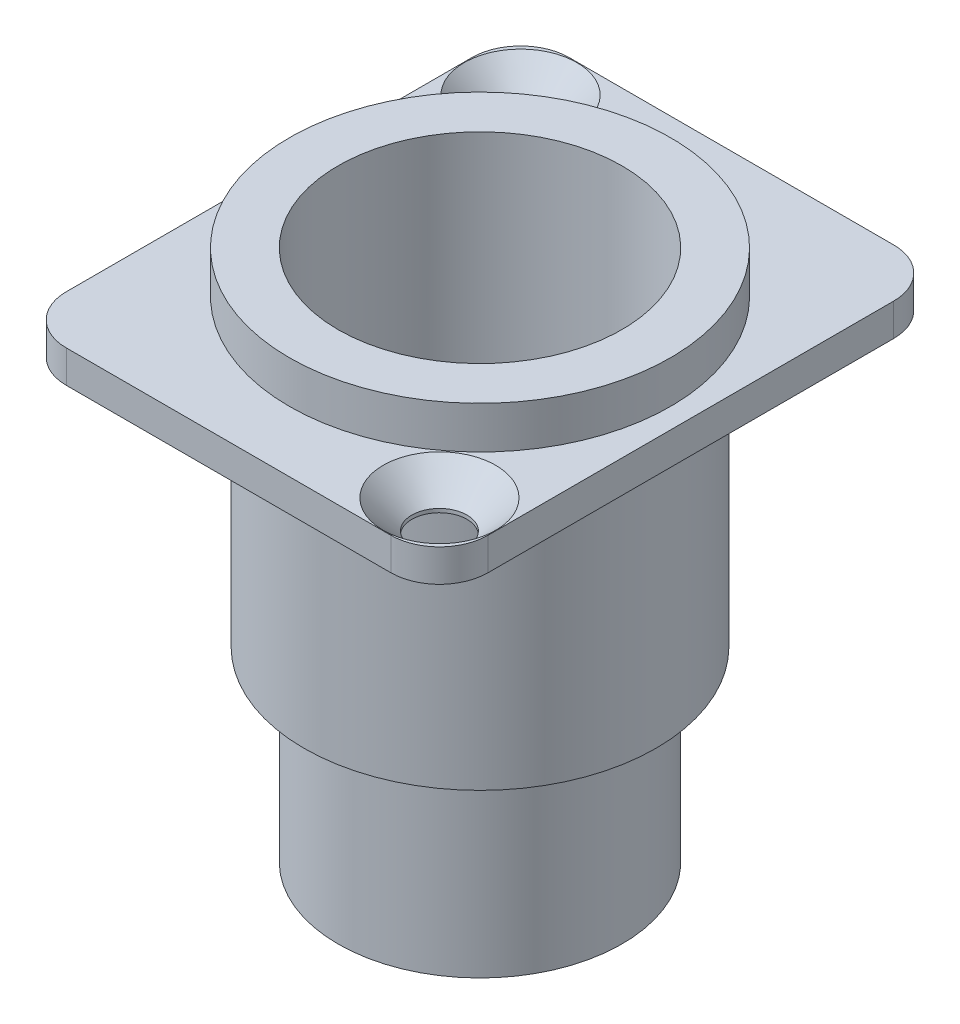
from build123d import *

# Parameters (mm, degrees)
CROQUIS1_W                                           = 26
CROQUIS1_H                                           = 31
CROQUIS1_R                                           = 8.75
CROQUIS1_R_2                                         = 1.7
SALIENTE_EXTRUIR1_DEPTH                              = 2
REDONDEO1_R                                          = 3
CROQUIS2_R                                           = 11.75
CROQUIS2_R_2                                         = 8.75
SALIENTE_EXTRUIR2_DEPTH                              = 2.6
SALIENTE_EXTRUIR3_START                              = 16.7
CROQUIS3_R                                           = 10.85
CROQUIS3_R_2                                         = 8.75
SALIENTE_EXTRUIR3_DEPTH                              = 16.7
AVELLANADO_PARA_TORNILLOS_CON_CABEZA_AVE_D           = 3.4
AVELLANADO_PARA_TORNILLOS_CON_CABEZA_AVE_DEPTH       = 15
AVELLANADO_PARA_TORNILLOS_CON_CABEZA_AVE_CSINK_D     = 6.94
AVELLANADO_PARA_TORNILLOS_CON_CABEZA_AVE_CSINK_ANGLE = 90
AVELLANADO_PARA_TORNILLOS_CON_CABEZA_AVE_TIP         = 1.021463052
CROQUIS6_R                                           = 8.75
SALIENTE_EXTRUIR4_DEPTH                              = 32.8
CROQUIS7_W                                           = 12.7
CROQUIS7_H                                           = 5.4
CORTAR_EXTRUIR1_DEPTH                                = 10
CROQUIS8_W                                           = 12.7
CROQUIS8_H                                           = 5.4
CORTAR_EXTRUIR2_DEPTH                                = 10
CROQUIS9_W                                           = 12.7
CROQUIS9_H                                           = 5.4
CROQUIS9_W_2                                         = 12.3
CROQUIS9_H_2                                         = 5
SALIENTE_EXTRUIR5_DEPTH                              = 10
CROQUIS10_W                                          = 12.7
CROQUIS10_H                                          = 5.4
CROQUIS10_W_2                                        = 12.3
CROQUIS10_H_2                                        = 5
SALIENTE_EXTRUIR6_DEPTH                              = 10
CROQUIS11_W                                          = 12.3
CROQUIS11_H                                          = 5
SALIENTE_EXTRUIR7_DEPTH                              = 0.7
CROQUIS12_W                                          = 12.3
CROQUIS12_H                                          = 5
SALIENTE_EXTRUIR8_DEPTH                              = 0.7
CROQUIS13_W                                          = 11
CROQUIS13_H                                          = 2
SALIENTE_EXTRUIR9_DEPTH                              = 9
CROQUIS14_W                                          = 11
CROQUIS14_H                                          = 2
SALIENTE_EXTRUIR10_DEPTH                             = 9
CHAFL_N1_SIZE                                        = 0.5
CHAFL_N2_SIZE                                        = 0.5
CUT_EXTRUDE1_START                                   = -20
SKETCH1_R                                            = 8.75
CUT_EXTRUDE1_DEPTH                                   = 20


with BuildPart() as part:
    # Croquis1 → Saliente-Extruir1 (new body)
    with BuildSketch(Plane(origin=(0, 0, 0), x_dir=(1, 0, 0), z_dir=(0, 1, 0))):
        Rectangle(CROQUIS1_W, CROQUIS1_H)
        with Locations(Location((0, 0, 0), (0, 0, 270))):
            Circle(CROQUIS1_R, mode=Mode.SUBTRACT)
        with Locations(Location((-9.5, 12, 0), (0, 0, 270))):
            Circle(CROQUIS1_R_2, mode=Mode.SUBTRACT)
        with Locations(Location((9.5, -12, 0), (0, 0, 270))):
            Circle(CROQUIS1_R_2, mode=Mode.SUBTRACT)
    extrude(amount=SALIENTE_EXTRUIR1_DEPTH)

    # Redondeo1
    redondeo1_edges = [part.edges().sort_by_distance(p)[0] for p in [
        (13, 1, 15.5),
        (-13, 1, 15.5),
        (-13, 1, -15.5),
        (13, 1, -15.5),
    ]]
    fillet(redondeo1_edges, radius=REDONDEO1_R)

    # Croquis2 → Saliente-Extruir2 (add)
    with BuildSketch(Plane(origin=(0, 2, 0), x_dir=(1, 0, 0), z_dir=(0, 1, 0))):
        with Locations(Location((0, 0, 0), (0, 0, 270))):
            Circle(CROQUIS2_R)
        with Locations(Location((0, 0, 0), (0, 0, 270))):
            Circle(CROQUIS2_R_2, mode=Mode.SUBTRACT)
    extrude(amount=SALIENTE_EXTRUIR2_DEPTH)

    # Croquis3 → Saliente-Extruir3 (add)
    with BuildSketch(Plane.XZ.offset(SALIENTE_EXTRUIR3_START)):
        with Locations(Location((0, 0, 0), (0, 0, 270))):
            Circle(CROQUIS3_R)
        with Locations(Location((0, 0, 0), (0, 0, 270))):
            Circle(CROQUIS3_R_2, mode=Mode.SUBTRACT)
    extrude(amount=-SALIENTE_EXTRUIR3_DEPTH)

    # Avellanado para tornillos con cabeza avellanada de clavija de M31
    with Locations(Plane(origin=(0, 2, 0), x_dir=(1, 0, 0), z_dir=(0, 1, 0))):
        with Locations((9.5, -12), (-9.5, 12)):
            CounterSinkHole(AVELLANADO_PARA_TORNILLOS_CON_CABEZA_AVE_D / 2, AVELLANADO_PARA_TORNILLOS_CON_CABEZA_AVE_CSINK_D / 2, depth=AVELLANADO_PARA_TORNILLOS_CON_CABEZA_AVE_DEPTH, counter_sink_angle=AVELLANADO_PARA_TORNILLOS_CON_CABEZA_AVE_CSINK_ANGLE)
            with Locations((0, 0, -(AVELLANADO_PARA_TORNILLOS_CON_CABEZA_AVE_DEPTH + AVELLANADO_PARA_TORNILLOS_CON_CABEZA_AVE_TIP / 2))):  # 118° drill point
                Cone(0, AVELLANADO_PARA_TORNILLOS_CON_CABEZA_AVE_D / 2, AVELLANADO_PARA_TORNILLOS_CON_CABEZA_AVE_TIP, mode=Mode.SUBTRACT)


with BuildPart() as body_2:
    # Croquis6 → Saliente-Extruir4 (new body)
    with BuildSketch(Plane(origin=(0, 4.6, 0), x_dir=(1, 0, 0), z_dir=(0, 1, 0))):
        with Locations(Location((0, 0, 0), (0, 0, 270))):
            Circle(CROQUIS6_R)
    extrude(amount=-SALIENTE_EXTRUIR4_DEPTH)

    # Croquis7 → Cortar-Extruir1 (cut)
    with BuildSketch(Plane(origin=(0, 4.6, 0), x_dir=(1, 0, 0), z_dir=(0, 1, 0))):
        Rectangle(CROQUIS7_W, CROQUIS7_H)
    extrude(amount=-CORTAR_EXTRUIR1_DEPTH, mode=Mode.SUBTRACT)

    # Croquis8 → Cortar-Extruir2 (cut)
    with BuildSketch(Plane.XZ.offset(28.2)):
        Rectangle(CROQUIS8_W, CROQUIS8_H)
    extrude(amount=-CORTAR_EXTRUIR2_DEPTH, mode=Mode.SUBTRACT)


with BuildPart() as body_3:
    # Croquis9 → Saliente-Extruir5 (new body)
    with BuildSketch(Plane.XZ.offset(28.2)):
        Rectangle(CROQUIS9_W, CROQUIS9_H)
        Rectangle(CROQUIS9_W_2, CROQUIS9_H_2, mode=Mode.SUBTRACT)
    extrude(amount=-SALIENTE_EXTRUIR5_DEPTH)


with BuildPart() as body_4:
    # Croquis10 → Saliente-Extruir6 (new body)
    with BuildSketch(Plane(origin=(0, 4.6, 0), x_dir=(1, 0, 0), z_dir=(0, 1, 0))):
        Rectangle(CROQUIS10_W, CROQUIS10_H)
        Rectangle(CROQUIS10_W_2, CROQUIS10_H_2, mode=Mode.SUBTRACT)
    extrude(amount=-SALIENTE_EXTRUIR6_DEPTH)


with BuildPart() as body_5:
    # Croquis11 → Saliente-Extruir7 (new body)
    with BuildSketch(Plane(origin=(0, -5.4, 0), x_dir=(1, 0, 0), z_dir=(0, 1, 0))):
        Rectangle(CROQUIS11_W, CROQUIS11_H)
    extrude(amount=SALIENTE_EXTRUIR7_DEPTH)


with BuildPart() as body_6:
    # Croquis12 → Saliente-Extruir8 (new body)
    with BuildSketch(Plane.XZ.offset(18.2)):
        Rectangle(CROQUIS12_W, CROQUIS12_H)
    extrude(amount=SALIENTE_EXTRUIR8_DEPTH)


with BuildPart() as body_7:
    # Croquis13 → Saliente-Extruir9 (new body)
    with BuildSketch(Plane(origin=(0, -4.7, 0), x_dir=(1, 0, 0), z_dir=(0, 1, 0))):
        with Locations((0, -0.7)):
            Rectangle(CROQUIS13_W, CROQUIS13_H)
    extrude(amount=SALIENTE_EXTRUIR9_DEPTH)

    # Chaflán1
    chafl_n1_edges = [body_7.edges().sort_by_distance(p)[0] for p in [
        (-5.5, 4.3, 0.7),
        (0, 4.3, 1.7),
        (5.5, 4.3, 0.7),
        (0, 4.3, -0.3),
    ]]
    chamfer(chafl_n1_edges, length=CHAFL_N1_SIZE)


with BuildPart() as body_8:
    # Croquis14 → Saliente-Extruir10 (new body)
    with BuildSketch(Plane.XZ.offset(18.9)):
        with Locations((0, 0.7)):
            Rectangle(CROQUIS14_W, CROQUIS14_H)
    extrude(amount=SALIENTE_EXTRUIR10_DEPTH)

    # Chaflán2
    chafl_n2_edges = [body_8.edges().sort_by_distance(p)[0] for p in [
        (0, -27.9, -0.3),
        (5.5, -27.9, 0.7),
        (0, -27.9, 1.7),
        (-5.5, -27.9, 0.7),
    ]]
    chamfer(chafl_n2_edges, length=CHAFL_N2_SIZE)


with BuildPart() as cut_extrude1_tool:
    # Sketch1 → Cut-Extrude1 (new body)
    with BuildSketch(Plane(origin=(0, 4.6, 0), x_dir=(1, 0, 0), z_dir=(0, 1, 0)).offset(CUT_EXTRUDE1_START)):
        with Locations(Location((0, 0, 0), (0, 0, 270))):
            Circle(SKETCH1_R)
    extrude(amount=CUT_EXTRUDE1_DEPTH)


with BuildPart() as body_2_1:
    add(body_2.part)

    # Cut-Extrude1: cut by cut_extrude1_tool
    add(cut_extrude1_tool.part, mode=Mode.SUBTRACT)


with BuildPart() as body_4_1:
    add(body_4.part)

    # Cut-Extrude1: cut by cut_extrude1_tool
    add(cut_extrude1_tool.part, mode=Mode.SUBTRACT)


with BuildPart() as body_5_1:
    add(body_5.part)

    # Cut-Extrude1: cut by cut_extrude1_tool
    add(cut_extrude1_tool.part, mode=Mode.SUBTRACT)


with BuildPart() as body_7_1:
    add(body_7.part)

    # Cut-Extrude1: cut by cut_extrude1_tool
    add(cut_extrude1_tool.part, mode=Mode.SUBTRACT)


solid = Compound([part.part, body_3.part, body_6.part, body_8.part, body_2_1.part])
